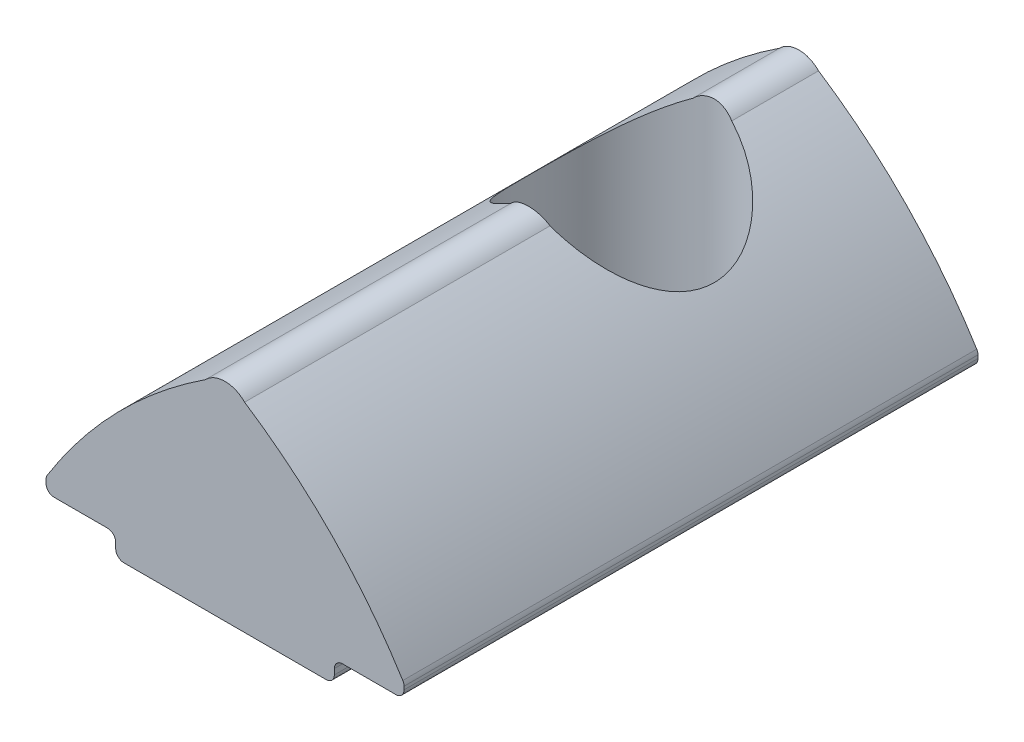
from build123d import *

# Parameters (mm, degrees)
EXTRUDE_1_DEPTH    = 10.5
HOLE_WIZARD_M8_1_D = 6.8


with BuildPart() as part:
    # 草图1 → 凸台-拉伸1 (new, symmetric)
    with BuildSketch(Plane.XY):
        with BuildLine():
            Line((-3.7, 0), (3.7, 0))
            ThreePointArc((3.7, 0), (3.912132034, 0.087867966), (4, 0.3))
            Line((4, 0.3), (4, 0.5))
            ThreePointArc((4, 0.5), (4.087867966, 0.712132034), (4.3, 0.8))
            Line((4.3, 0.8), (6.25, 0.8))
            ThreePointArc((6.25, 0.8), (6.462132034, 0.887867966), (6.55, 1.1))
            Line((6.55, 1.1), (6.55, 1.214694733))
            ThreePointArc((6.55, 1.214694733), (6.538468452, 1.297071625), (6.504760317, 1.37311563))
            ThreePointArc((6.504760317, 1.37311563), (3.934117906, 4.65105617), (0.716844819, 7.297232748))
            ThreePointArc((0.716844819, 7.297232748), (0, 7.6), (-0.716844819, 7.297232748))
            ThreePointArc((-0.716844819, 7.297232748), (-3.934117906, 4.65105617), (-6.504760317, 1.37311563))
            ThreePointArc((-6.504760317, 1.37311563), (-6.538468452, 1.297071625), (-6.55, 1.214694733))
            Line((-6.55, 1.214694733), (-6.55, 1.1))
            ThreePointArc((-6.55, 1.1), (-6.462132034, 0.887867966), (-6.25, 0.8))
            Line((-6.25, 0.8), (-4.3, 0.8))
            ThreePointArc((-4.3, 0.8), (-4.087867966, 0.712132034), (-4, 0.5))
            Line((-4, 0.5), (-4, 0.3))
            ThreePointArc((-4, 0.3), (-3.912132034, 0.087867966), (-3.7, 0))
        make_face()
    extrude(amount=EXTRUDE_1_DEPTH, both=True)

    # M8 螺纹孔1 (through all)
    with Locations(Plane(origin=(0, 0, -4), x_dir=(0, 0, -1), z_dir=(0, -1, 0))):
        with Locations((0, 0)):
            Hole(HOLE_WIZARD_M8_1_D / 2)


solid = part.part
